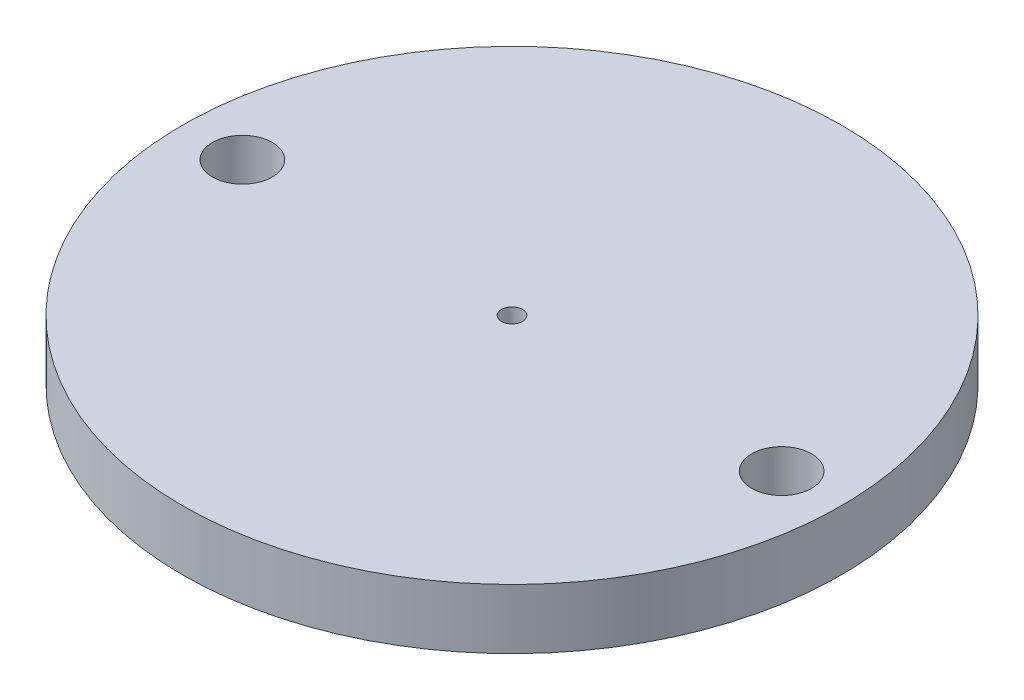
from build123d import *

# Parameters (mm, degrees)
SKETCH1_R           = 55
SKETCH1_R_2         = 1.75
SKETCH1_R_3         = 5
BOSS_EXTRUDE1_DEPTH = 10


with BuildPart() as part:
    # Sketch1 → Boss-Extrude1 (new body)
    with BuildSketch(Plane(origin=(0, 0, 0), x_dir=(1, 0, 0), z_dir=(0, 1, 0))):
        with Locations(Location((0, 0, 0), (0, 0, 270))):
            Circle(SKETCH1_R)
        with Locations(Location((0, 0, 0), (0, 0, 270))):
            Circle(SKETCH1_R_2, mode=Mode.SUBTRACT)
        with Locations(Location((-45, 0, 0), (0, 0, 270))):
            Circle(SKETCH1_R_3, mode=Mode.SUBTRACT)
        with Locations(Location((45, 0, 0), (0, 0, 90))):
            Circle(SKETCH1_R_3, mode=Mode.SUBTRACT)
    extrude(amount=BOSS_EXTRUDE1_DEPTH)


solid = part.part
